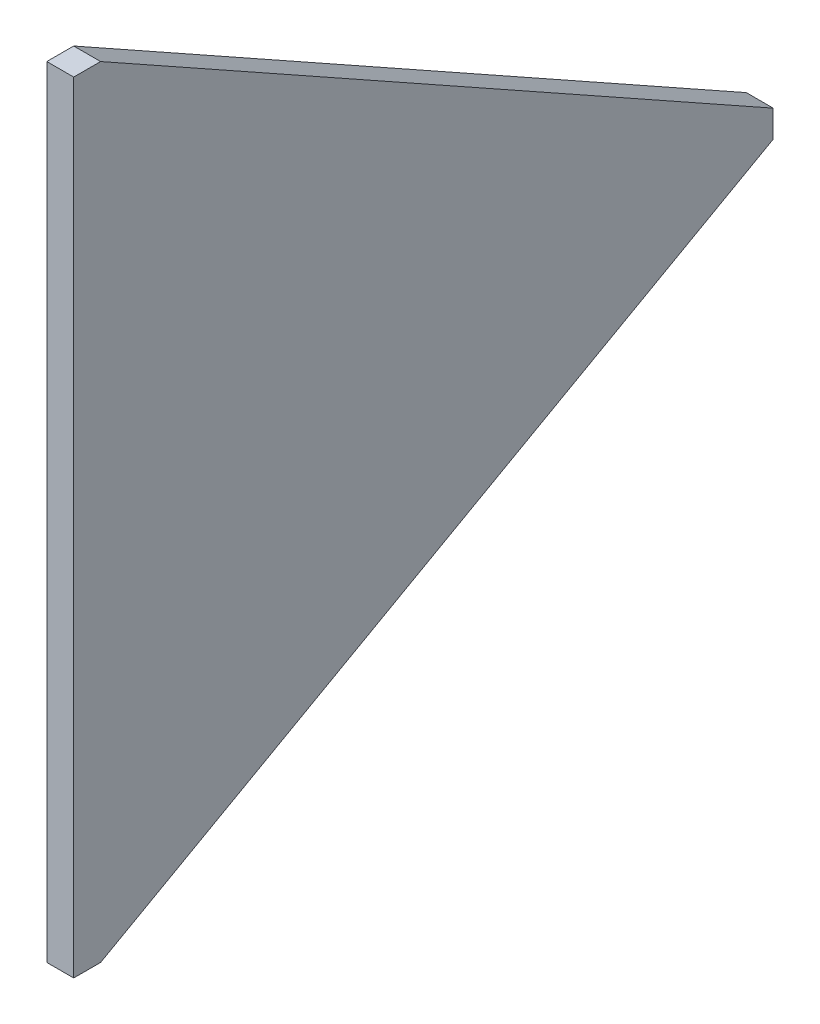
from build123d import *

# Parameters (mm, degrees)
BOSS_EXTRUDE1_DEPTH = 2


with BuildPart() as part:
    # Sketch1 → Boss-Extrude1 (new body)
    with BuildSketch(Plane(origin=(0, 0, 0), x_dir=(0, 0, -1), z_dir=(1, 0, 0))):
        Polygon((0, 29), (0, -29), (2, -29), (52, -1), (52, 1), (2, 29), align=None)
    extrude(amount=BOSS_EXTRUDE1_DEPTH)


solid = part.part
